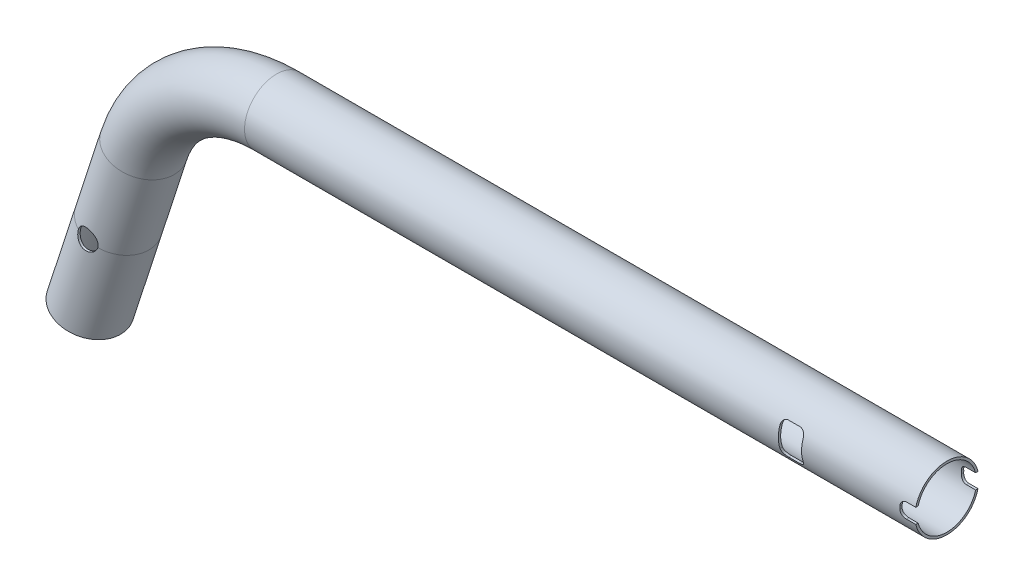
from build123d import *

# Parameters (mm, degrees)
SKETCH3_R               = 11
SKETCH3_R_2             = 10.2
CUT_EXTRUDE1_REACH      = 194.875
SKETCH4_R               = 3.5
SKETCH5_R               = 3.3
CUT_EXTRUDE2_DEPTH      = 193.875317702
CUT_EXTRUDE3_DEPTH      = 193.875317702
CUT_EXTRUDE3_DEPTH_BACK = 193.875317702


with BuildPart() as part:
    # Sweep2: sweep along a path in Sketch1
    with BuildLine(Plane.XY) as sweep2_path:
        Line((136.815388441, 0), (93.815388441, 0))
        Line((93.815388441, 0), (-93.815388441, 0))
        ThreePointArc((-93.815388441, 0), (-122.029080551, -9.16718427), (-139.466101223, -33.16718427))
        Line((-139.466101223, -33.16718427), (-148.184611559, -60))
        Line((-148.184611559, -60), (-157.932202446, -90))
    # Sketch3 → Sweep2 (sweep)
    with BuildSketch(Plane(origin=(93.815388441, 0, 0), x_dir=(0, 0, -1), z_dir=(1, 0, 0))):
        Circle(SKETCH3_R)
        Circle(SKETCH3_R_2, mode=Mode.SUBTRACT)
    sweep(path=sweep2_path.line)

    # Sketch4 → Cut-Extrude1 (cut, up to next)
    with BuildSketch(Plane.XY, mode=Mode.PRIVATE) as cut_extrude1_sk1:
        with Locations((-148.184611559, -60)):
            Circle(SKETCH4_R)
    cut_extrude1_tool1 = extrude(cut_extrude1_sk1.sketch, amount=CUT_EXTRUDE1_REACH, mode=Mode.PRIVATE) & part.part
    # Sketch4 → Cut-Extrude1 (cut, up to next)
    with BuildSketch(Plane.XY, mode=Mode.PRIVATE) as cut_extrude1_sk2:
        with BuildLine():
            Line((91.815388441, -5.5), (95.815388441, -5.5))
            ThreePointArc((95.815388441, -5.5), (97.229602003, -4.914213562), (97.815388441, -3.5))
            Line((97.815388441, -3.5), (97.815388441, 3.5))
            ThreePointArc((97.815388441, 3.5), (97.229602003, 4.914213562), (95.815388441, 5.5))
            Line((95.815388441, 5.5), (91.815388441, 5.5))
            ThreePointArc((91.815388441, 5.5), (90.401174879, 4.914213562), (89.815388441, 3.5))
            Line((89.815388441, 3.5), (89.815388441, -3.5))
            ThreePointArc((89.815388441, -3.5), (90.401174879, -4.914213562), (91.815388441, -5.5))
        make_face()
    cut_extrude1_tool2 = extrude(cut_extrude1_sk2.sketch, amount=CUT_EXTRUDE1_REACH, mode=Mode.PRIVATE) & part.part
    add(cut_extrude1_tool1.solids().sort_by_distance((-148.184612, -60, 0))[0], mode=Mode.SUBTRACT)
    add(cut_extrude1_tool2.solids().sort_by_distance((93.815388, 0, 0))[0], mode=Mode.SUBTRACT)

    # Sketch5 → Cut-Extrude2 (cut, through all)
    with BuildSketch(Plane.XY):
        with Locations((-148.184611559, -60)):
            Circle(SKETCH5_R)
    extrude(amount=-CUT_EXTRUDE2_DEPTH, mode=Mode.SUBTRACT)

    # Sketch6 → Cut-Extrude3 (cut, two sides: drawn at the far end of the back side and taken through both)
    with BuildSketch(Plane.XY.offset(-CUT_EXTRUDE3_DEPTH_BACK)):
        with BuildLine():
            Line((136.889174497, 2.554733627), (136.815388441, -2.554733627))
            Line((136.815388441, -2.554733627), (133.615388441, -2.554733627))
            ThreePointArc((133.615388441, -2.554733627), (132.201174879, -1.968947189), (131.615388441, -0.554733627))
            Line((131.615388441, -0.554733627), (131.615388441, 0.554733627))
            ThreePointArc((131.615388441, 0.554733627), (132.201174879, 1.968947189), (133.615388441, 2.554733627))
            Line((133.615388441, 2.554733627), (136.889174497, 2.554733627))
        make_face()
    extrude(amount=CUT_EXTRUDE3_DEPTH + CUT_EXTRUDE3_DEPTH_BACK, mode=Mode.SUBTRACT)


solid = part.part
